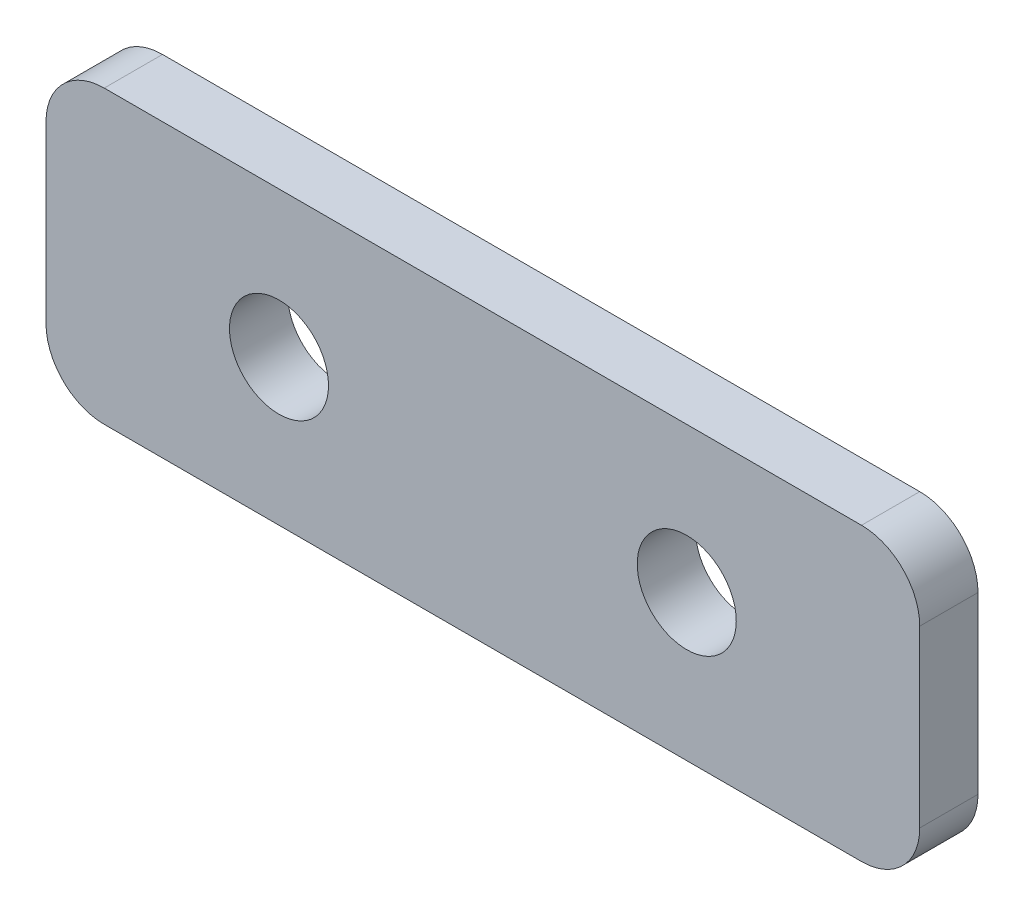
from build123d import *

# Parameters (mm, degrees)
SKETCH1_W            = 30
SKETCH1_H            = 10
BOSS_EXTRUDE1_DEPTH  = 2
FILLET2_R            = 2
M3_CLEARANCE_HOLE1_D = 3.4


with BuildPart() as part:
    # Sketch1 → Boss-Extrude1 (new body)
    with BuildSketch(Plane.XY):
        Rectangle(SKETCH1_W, SKETCH1_H)
    extrude(amount=BOSS_EXTRUDE1_DEPTH)

    # Fillet2
    fillet2_edges = [part.edges().sort_by_distance(p)[0] for p in [
        (15, -5, 1),
        (-15, -5, 1),
        (-15, 5, 1),
        (15, 5, 1),
    ]]
    fillet(fillet2_edges, radius=FILLET2_R)

    # M3 Clearance Hole1 (through all)
    with Locations(Plane.XY.offset(2)):
        with Locations((-7, 0), (7, 0)):
            Hole(M3_CLEARANCE_HOLE1_D / 2)


solid = part.part
